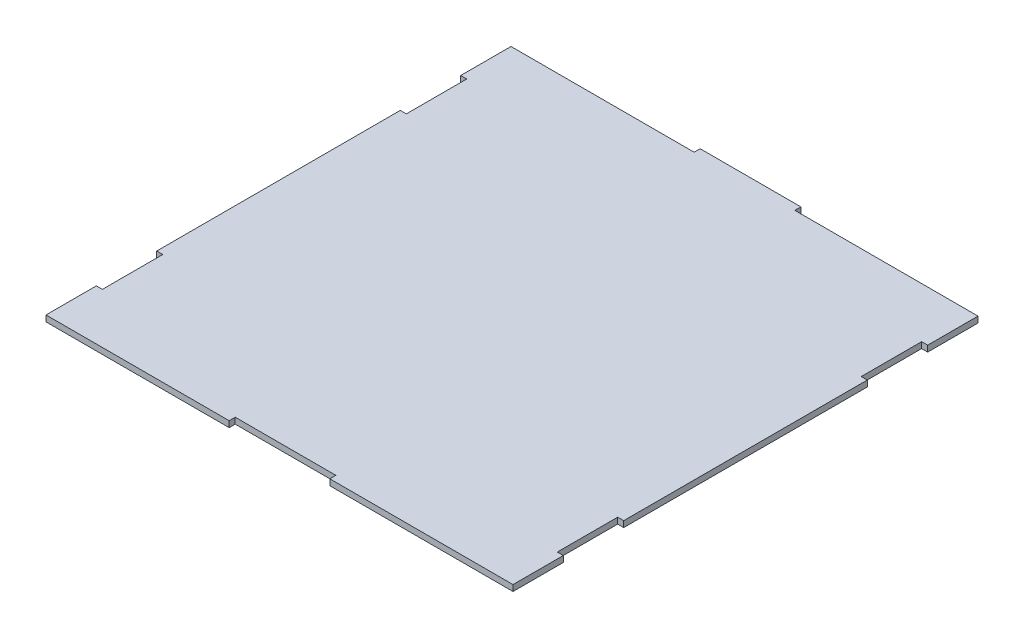
from build123d import *

# Parameters (mm, degrees)
RESSALTO_EXTRUS_O1_DEPTH = 3


with BuildPart() as part:
    # Esboço1 → Ressalto-extrusão1 (new body)
    with BuildSketch(Plane(origin=(0, 0, 0), x_dir=(1, 0, 0), z_dir=(0, 1, 0))):
        Polygon((0, 0), (0, 25), (3, 25), (3, 55), (0, 55), (0, 176), (3, 176), (3, 206), (0, 206), (0, 231), (91, 231), (91, 234), (141, 234), (141, 231), (232, 231), (232, 206), (229, 206), (229, 176), (232, 176), (232, 55), (229, 55), (229, 25), (232, 25), (232, 0), (141, 0), (141, 3), (91, 3), (91, 0), align=None)
    extrude(amount=RESSALTO_EXTRUS_O1_DEPTH)


solid = part.part
